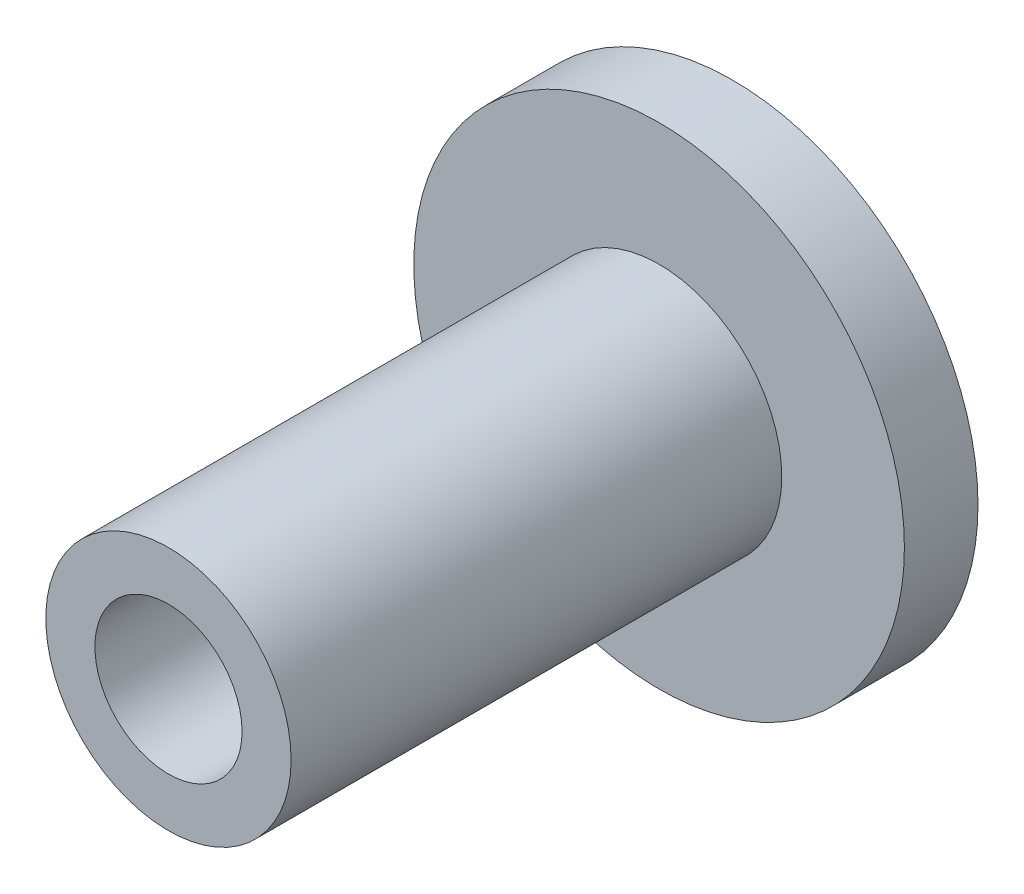
from build123d import *

# Parameters (mm, degrees)
SKETCH1_R           = 10
BOSS_EXTRUDE1_DEPTH = 3
SKETCH2_R           = 5
BOSS_EXTRUDE2_DEPTH = 20
SKETCH3_R           = 3
CUT_EXTRUDE1_DEPTH  = 28


with BuildPart() as part:
    # Sketch1 → Boss-Extrude1 (new body)
    with BuildSketch(Plane.XY):
        Circle(SKETCH1_R)
    extrude(amount=BOSS_EXTRUDE1_DEPTH)

    # Sketch2 → Boss-Extrude2 (add)
    with BuildSketch(Plane.XY.offset(3)):
        Circle(SKETCH2_R)
    extrude(amount=BOSS_EXTRUDE2_DEPTH)

    # Sketch3 → Cut-Extrude1 (cut, through all)
    with BuildSketch(Plane.XY.offset(23)):
        Circle(SKETCH3_R)
    extrude(amount=-CUT_EXTRUDE1_DEPTH, mode=Mode.SUBTRACT)


solid = part.part
